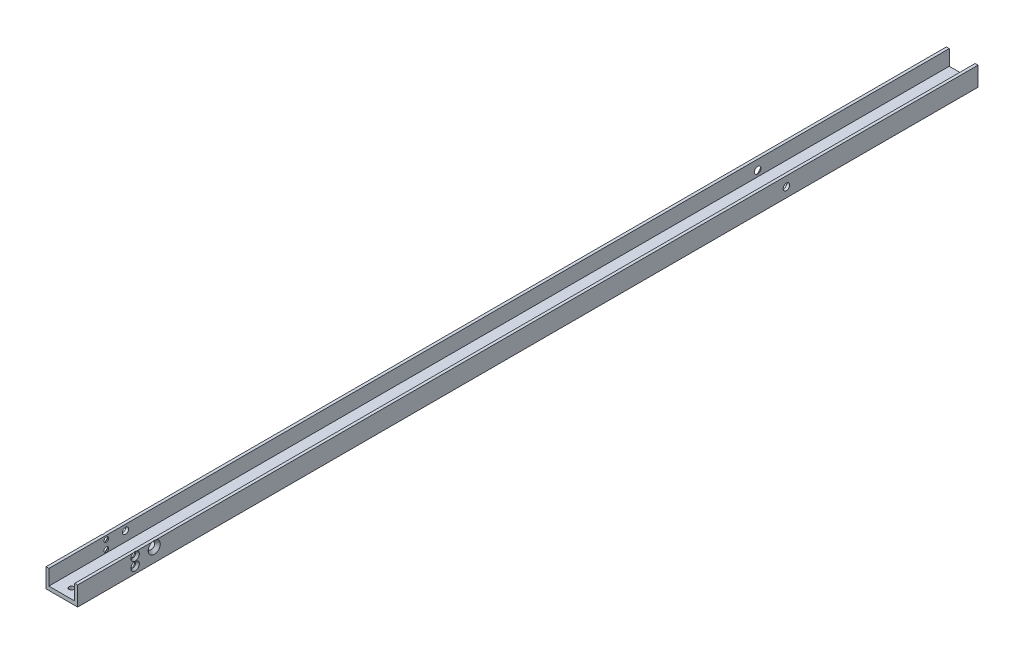
from build123d import *

# Parameters (mm, degrees)
BOSS_EXTRU_1_DEPTH                                   = 470
ESQUISSE2_R                                          = 1.15
ESQUISSE2_R_2                                        = 1.6
ENL_V_MAT_EXTRU_1_DEPTH                              = 471.395843944
TROU_POUR_TARAUDAGE_POUR_TROU_TARAUD_M3_D            = 2.5
FORMSENKUNG_F_R_M2_SENKSCHRAUBE_MIT_SCHL_D           = 2.4
FORMSENKUNG_F_R_M2_SENKSCHRAUBE_MIT_SCHL_DEPTH       = 5
FORMSENKUNG_F_R_M2_SENKSCHRAUBE_MIT_SCHL_CSINK_D     = 4.4
FORMSENKUNG_F_R_M2_SENKSCHRAUBE_MIT_SCHL_CSINK_ANGLE = 90
FORMSENKUNG_F_R_M2_SENKSCHRAUBE_MIT_SCHL_TIP         = 0.721032743
FORMSENKUNG_F_R_M2_SENKSCHRAUBE_MIT_2_D              = 2.4
FORMSENKUNG_F_R_M2_SENKSCHRAUBE_MIT_2_DEPTH          = 5
FORMSENKUNG_F_R_M2_SENKSCHRAUBE_MIT_2_CSINK_D        = 4.4
FORMSENKUNG_F_R_M2_SENKSCHRAUBE_MIT_2_CSINK_ANGLE    = 90
FORMSENKUNG_F_R_M2_SENKSCHRAUBE_MIT_2_TIP            = 0.721032743
FORMSENKUNG_F_R_M3_SENKSCHRAUBE_MIT_SCHL_D           = 3.4
FORMSENKUNG_F_R_M3_SENKSCHRAUBE_MIT_SCHL_DEPTH       = 5
FORMSENKUNG_F_R_M3_SENKSCHRAUBE_MIT_SCHL_CSINK_D     = 6.3
FORMSENKUNG_F_R_M3_SENKSCHRAUBE_MIT_SCHL_CSINK_ANGLE = 90
FORMSENKUNG_F_R_M3_SENKSCHRAUBE_MIT_SCHL_TIP         = 1.021463052
FORMSENKUNG_F_R_M3_SENKSCHRAUBE_MIT_2_D              = 3.4
FORMSENKUNG_F_R_M3_SENKSCHRAUBE_MIT_2_CSINK_D        = 6.3
FORMSENKUNG_F_R_M3_SENKSCHRAUBE_MIT_2_CSINK_ANGLE    = 90


with BuildPart() as part:
    # Esquisse1 → Boss.-Extru.1 (new body)
    with BuildSketch(Plane.XY):
        Polygon((-8.25, 0), (8.25, 0), (8.25, 10), (6.75, 10), (6.75, 2), (-6.75, 2), (-6.75, 10), (-8.25, 10), align=None)
    extrude(amount=BOSS_EXTRU_1_DEPTH)

    # Esquisse2 → Enlèv. mat.-Extru.1 (cut, through all)
    with BuildSketch(Plane(origin=(8.25, 0, 0), x_dir=(0, 0, -1), z_dir=(1, 0, 0))):
        with Locations((-440, 8)):
            Circle(ESQUISSE2_R)
        with Locations((-440, 3.5)):
            Circle(ESQUISSE2_R)
        with Locations((-430, 7)):
            Circle(ESQUISSE2_R_2)
    extrude(amount=-ENL_V_MAT_EXTRU_1_DEPTH, mode=Mode.SUBTRACT)

    # Trou pour taraudage pour trou taraudé M31 (through all)
    with Locations(Plane(origin=(0, 2, 0), x_dir=(1, 0, 0), z_dir=(0, 1, 0))):
        with Locations((0, -465)):
            Hole(TROU_POUR_TARAUDAGE_POUR_TROU_TARAUD_M3_D / 2)

    # Formsenkung f_r M2 Senkschraube mit Schl
    with Locations(Plane(origin=(8.25, 0, 0), x_dir=(0, 0, -1), z_dir=(1, 0, 0))):
        with Locations((-440, 3.5), (-440, 8)):
            CounterSinkHole(FORMSENKUNG_F_R_M2_SENKSCHRAUBE_MIT_SCHL_D / 2, FORMSENKUNG_F_R_M2_SENKSCHRAUBE_MIT_SCHL_CSINK_D / 2, depth=FORMSENKUNG_F_R_M2_SENKSCHRAUBE_MIT_SCHL_DEPTH, counter_sink_angle=FORMSENKUNG_F_R_M2_SENKSCHRAUBE_MIT_SCHL_CSINK_ANGLE)
            with Locations((0, 0, -(FORMSENKUNG_F_R_M2_SENKSCHRAUBE_MIT_SCHL_DEPTH + FORMSENKUNG_F_R_M2_SENKSCHRAUBE_MIT_SCHL_TIP / 2))):  # 118° drill point
                Cone(0, FORMSENKUNG_F_R_M2_SENKSCHRAUBE_MIT_SCHL_D / 2, FORMSENKUNG_F_R_M2_SENKSCHRAUBE_MIT_SCHL_TIP, mode=Mode.SUBTRACT)

    # Formsenkung f_r M2 Senkschraube mit  2
    with Locations(Plane.ZY.offset(8.25)):
        with Locations((440, 8), (440, 3.5)):
            CounterSinkHole(FORMSENKUNG_F_R_M2_SENKSCHRAUBE_MIT_2_D / 2, FORMSENKUNG_F_R_M2_SENKSCHRAUBE_MIT_2_CSINK_D / 2, depth=FORMSENKUNG_F_R_M2_SENKSCHRAUBE_MIT_2_DEPTH, counter_sink_angle=FORMSENKUNG_F_R_M2_SENKSCHRAUBE_MIT_2_CSINK_ANGLE)
            with Locations((0, 0, -(FORMSENKUNG_F_R_M2_SENKSCHRAUBE_MIT_2_DEPTH + FORMSENKUNG_F_R_M2_SENKSCHRAUBE_MIT_2_TIP / 2))):  # 118° drill point
                Cone(0, FORMSENKUNG_F_R_M2_SENKSCHRAUBE_MIT_2_D / 2, FORMSENKUNG_F_R_M2_SENKSCHRAUBE_MIT_2_TIP, mode=Mode.SUBTRACT)

    # Formsenkung f_r M3 Senkschraube mit Schl
    with Locations(Plane(origin=(8.25, 0, 0), x_dir=(0, 0, -1), z_dir=(1, 0, 0))):
        with Locations((-430, 7)):
            CounterSinkHole(FORMSENKUNG_F_R_M3_SENKSCHRAUBE_MIT_SCHL_D / 2, FORMSENKUNG_F_R_M3_SENKSCHRAUBE_MIT_SCHL_CSINK_D / 2, depth=FORMSENKUNG_F_R_M3_SENKSCHRAUBE_MIT_SCHL_DEPTH, counter_sink_angle=FORMSENKUNG_F_R_M3_SENKSCHRAUBE_MIT_SCHL_CSINK_ANGLE)
            with Locations((0, 0, -(FORMSENKUNG_F_R_M3_SENKSCHRAUBE_MIT_SCHL_DEPTH + FORMSENKUNG_F_R_M3_SENKSCHRAUBE_MIT_SCHL_TIP / 2))):  # 118° drill point
                Cone(0, FORMSENKUNG_F_R_M3_SENKSCHRAUBE_MIT_SCHL_D / 2, FORMSENKUNG_F_R_M3_SENKSCHRAUBE_MIT_SCHL_TIP, mode=Mode.SUBTRACT)

    # Formsenkung f_r M3 Senkschraube mit  2 (through all)
    with Locations(Plane(origin=(-8.25, -1.5, 0), x_dir=(0, 0, -1), z_dir=(-1, 0, 0))):
        with Locations((-100, -6.5)):
            CounterSinkHole(FORMSENKUNG_F_R_M3_SENKSCHRAUBE_MIT_2_D / 2, FORMSENKUNG_F_R_M3_SENKSCHRAUBE_MIT_2_CSINK_D / 2, counter_sink_angle=FORMSENKUNG_F_R_M3_SENKSCHRAUBE_MIT_2_CSINK_ANGLE)


solid = part.part
